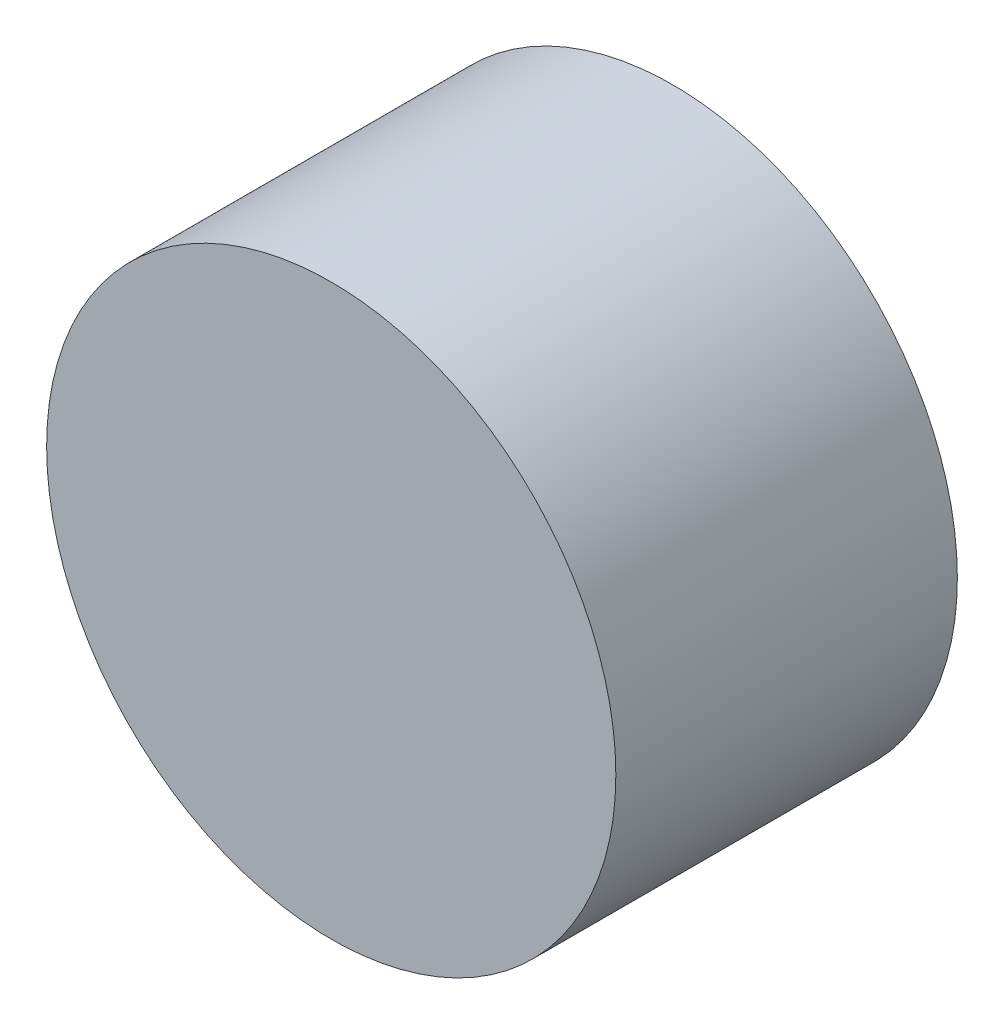
from build123d import *

# Parameters (mm, degrees)
SKETCH1_R           = 5
BOSS_EXTRUDE1_DEPTH = 6


with BuildPart() as part:
    # Sketch1 → Boss-Extrude1 (new body)
    with BuildSketch(Plane.XY):
        Circle(SKETCH1_R)
    extrude(amount=BOSS_EXTRUDE1_DEPTH)


solid = part.part
